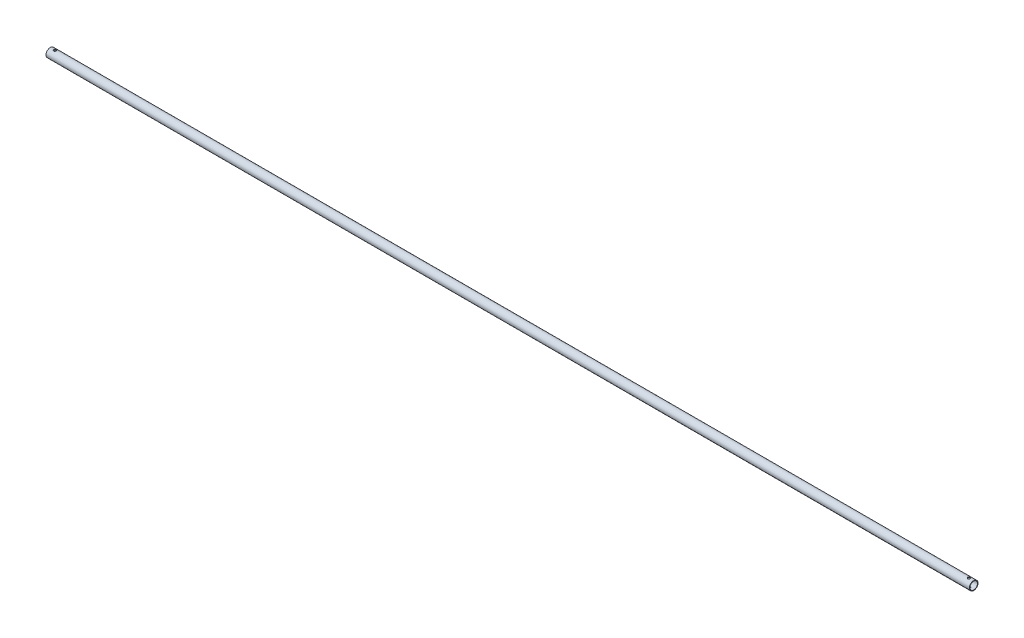
from build123d import *

# Parameters (mm, degrees)
SKETCH1_R           = 11.7094
SKETCH1_R_2         = 10.4648
BOSS_EXTRUDE1_DEPTH = 2501.9
SKETCH2_R           = 3.3782
CUT_EXTRUDE1_DEPTH  = 2502.954801769


with BuildPart() as part:
    # Sketch1 → Boss-Extrude1 (new body)
    with BuildSketch(Plane(origin=(0, 0, 0), x_dir=(0, 0, -1), z_dir=(1, 0, 0))):
        with Locations(Location((0, 0, 0), (0, 0, 180))):
            Circle(SKETCH1_R)
        with Locations(Location((0, 0, 0), (0, 0, 180))):
            Circle(SKETCH1_R_2, mode=Mode.SUBTRACT)
    extrude(amount=BOSS_EXTRUDE1_DEPTH)

    # Sketch2 → Cut-Extrude1 (cut, symmetric)
    with BuildSketch(Plane(origin=(0, 0, 0), x_dir=(1, 0, 0), z_dir=(0, 1, 0))):
        with Locations(Location((12.7, 0, 0), (0, 0, 270))):
            Circle(SKETCH2_R)
    cut_extrude1 = extrude(amount=CUT_EXTRUDE1_DEPTH, both=True, mode=Mode.SUBTRACT)

    # Mirror1: Cut-Extrude1 across plane
    add(cut_extrude1.mirror(Plane.ZY.offset(-1250.95)), mode=Mode.SUBTRACT)


solid = part.part
